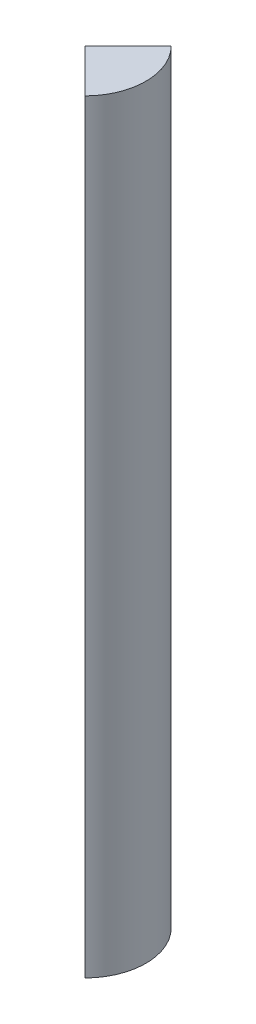
from build123d import *

# Parameters (mm, degrees)
SKETCH5_R                = 78.359
BOSS_EXTRUDE1_DEPTH      = 1117.6
CUT_EXTRUDE2_DEPTH       = 1883.863889443
BOSS_EXTRUDE3_DEPTH      = 1.27
BOSS_EXTRUDE4_DEPTH      = 7620
BOSS_EXTRUDE4_DEPTH_BACK = 5080


with BuildPart() as part:
    # Sketch4 → Revolve1 (revolve)
    with BuildSketch(Plane.YZ):
        with BuildLine():
            add(Edge.make_bspline(
                [(0, 0), (0.002272338, 0.010525317), (0.008561015, 0.031009867), (0.027689705, 0.069756925), (0.061239273, 0.124735634), (0.105324786, 0.185752869), (0.192338612, 0.292743497), (0.322874784, 0.430842392), (0.490263053, 0.587055669), (0.695016601, 0.7598799), (0.912926923, 0.931318831), (1.143240517, 1.10197974), (1.531804995, 1.374749944), (2.242570555, 1.834607161), (3.524849665, 2.579591801), (5.903846922, 3.797737268), (10.150615363, 5.693703914), (17.478480432, 8.523516836), (29.870634739, 12.646347877), (49.775460189, 18.3187623), (79.425215434, 25.51448835), (117.543255539, 33.338604399), (161.899434584, 41.077041953), (209.528749396, 48.168105347), (257.293142226, 54.274216652), (305.158994976, 59.520897511), (353.102640037, 63.996513764), (401.106648045, 67.766524351), (449.157215103, 70.883868143), (497.243146494, 73.39332762), (545.355125756, 75.337001384), (593.485273111, 76.756141879), (641.626977986, 77.698006858), (689.774868279, 78.216958862), (725.887462179, 78.34877941), (749.962507453, 78.359), (762, 78.359)],
                knots=[0, 0, 0, 0, 0, 5.5813e-05, 0.000111625, 0.000223251, 0.000334876, 0.000446501, 0.000828139, 0.001209777, 0.001524204, 0.001838631, 0.002269008, 0.002699385, 0.003991346, 0.006237054, 0.009973045, 0.016584104, 0.028152194, 0.047047102, 0.077827284, 0.124123811, 0.186686459, 0.249249025, 0.311811664, 0.374374313, 0.43693692, 0.499499542, 0.562062142, 0.624624763, 0.687187327, 0.749749772, 0.812312453, 0.874875111, 0.937437709, 1, 1, 1, 1, 1], degree=4))
            Line((0, 0), (762, 0))
            Line((762, 0), (762, 78.359))
        make_face()
    revolve(axis=Axis((0, 0, 0), (0, 1, 0)))

    # Sketch5 → Boss-Extrude1 (add)
    with BuildSketch(Plane(origin=(0, 762, 0), x_dir=(-1, 0, 0), z_dir=(0, 1, 0))):
        Circle(SKETCH5_R)
    extrude(amount=BOSS_EXTRUDE1_DEPTH)

    # Sketch10 → Cut-Extrude2 (cut, through all)
    with BuildSketch(Plane(origin=(0, 1879.6, 0), x_dir=(-1, 0, 0), z_dir=(0, 1, 0))):
        with BuildLine():
            Line((-55.408180267, 55.408180267), (0, 0))
            Line((0, 0), (-55.408180267, -55.408180267))
            ThreePointArc((-55.408180267, -55.408180267), (78.359, 0), (-55.408180267, 55.408180267))
        make_face()
    extrude(amount=-CUT_EXTRUDE2_DEPTH, mode=Mode.SUBTRACT)

    # Sketch14 → Boss-Extrude3 (add, symmetric)
    with BuildSketch(Plane(origin=(0, 0, 0), x_dir=(-1, 0, 0), z_dir=(0, 0, 1))):
        Polygon((-55.408180267, -1189.07274269), (-261.239, -1459.264314952), (-261.239, -1499.904314952), (-55.408180267, -1527.023926749), (-55.408180267, -1524), (-52.959, -1524), (-52.959, -1219.2), (-55.408180267, -1219.2), align=None)
    extrude(amount=BOSS_EXTRUDE3_DEPTH, both=True)


with BuildPart() as body_2:
    # Sketch15 → Boss-Extrude4 (new, two sides: drawn at the far end of the back side and taken through both)
    with BuildSketch(Plane(origin=(0, 1879.6, 0), x_dir=(-1, 0, 0), z_dir=(0, 1, 0)).offset(-BOSS_EXTRUDE4_DEPTH_BACK)):
        with BuildLine():
            Line((0, 0), (-718.420489686, 718.420489686))
            ThreePointArc((-718.420489686, 718.420489686), (-1016, 0), (-718.420489686, -718.420489686))
            Line((-718.420489686, -718.420489686), (0, 0))
        make_face()
    extrude(amount=BOSS_EXTRUDE4_DEPTH + BOSS_EXTRUDE4_DEPTH_BACK)

    # Combine1: cut part
    add(part.part, mode=Mode.SUBTRACT)


solid = body_2.part
